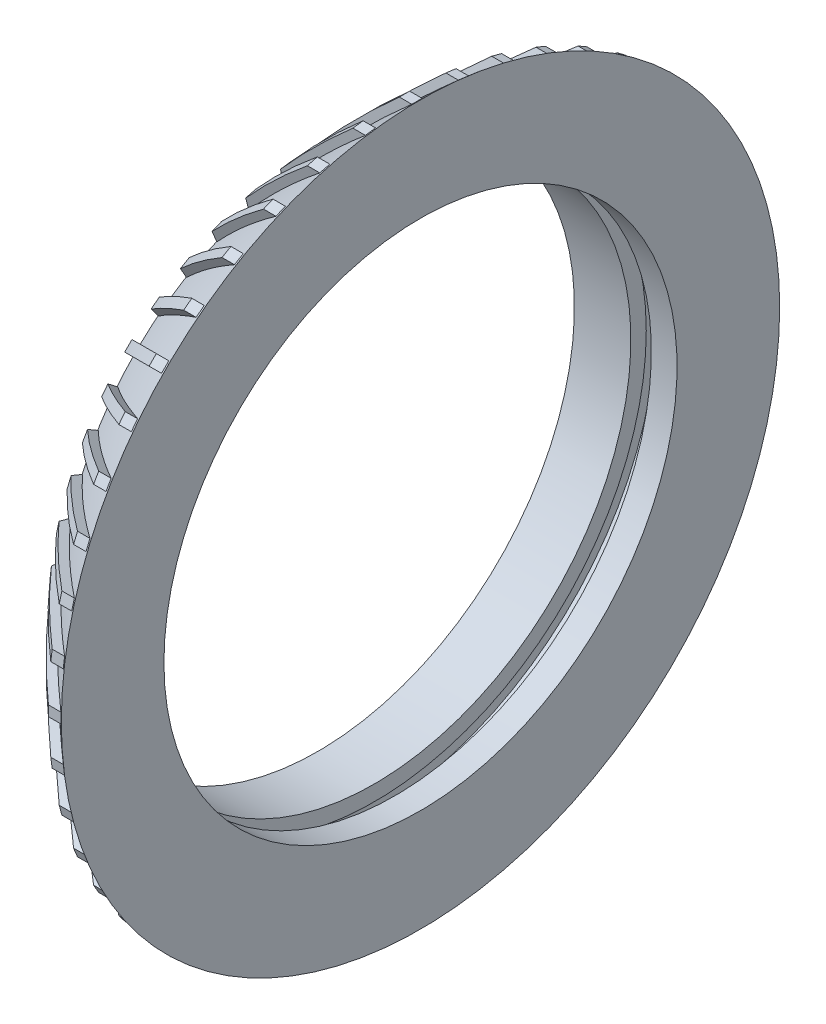
from build123d import *

# Parameters (mm, degrees)
BOSS_EXTRUDE1_DEPTH = 0.5
CIRPATTERN1_COUNT   = 48


with BuildPart() as part:
    # Sketch1 → Revolve1 (revolve)
    with BuildSketch(Plane(origin=(0, 0, 0), x_dir=(1, 0, 0), z_dir=(0, 1, 0)), mode=Mode.PRIVATE) as revolve1_sk:
        with BuildLine():
            Line((-10, 25), (-4.5, 25))
            Line((-4.5, 25), (-4.5, 26.5))
            Line((-4.5, 26.5), (-5, 26.5))
            Line((-5, 26.5), (-5, 28))
            Line((-5, 28), (-2, 28))
            Line((-2, 28), (-2, 26.5))
            Line((-2, 26.5), (-2.5, 26.5))
            Line((-2.5, 26.5), (-2.5, 25))
            Line((-2.5, 25), (0, 25))
            Line((0, 25), (0, 35))
            ThreePointArc((0, 35), (-5.17699822, 30.17699822), (-10, 25))
        make_face()
    revolve(revolve1_sk.sketch.rotate(Axis((-32.808988764, 0, 0), (1, 0, 0)), 180), axis=Axis((-32.808988764, 0, 0), (1, 0, 0)))

    # Sketch2 → Boss-Extrude1 (add, symmetric)
    with BuildSketch(Plane(origin=(0, 0, 0), x_dir=(1, 0, 0), z_dir=(0, 1, 0))):
        with BuildLine():
            Line((-9.670261687, 25.198786884), (-9.670261687, 26.585670293))
            ThreePointArc((-9.670261687, 26.585670293), (-5.729910505, 30.755454497), (-1.558714428, 34.694311059))
            Line((-1.558714428, 34.694311059), (-0.046724008, 34.694311059))
            ThreePointArc((-0.046724008, 34.694311059), (-5.019467946, 30.109694249), (-9.670261687, 25.198786884))
        make_face()
    boss_extrude1 = extrude(amount=BOSS_EXTRUDE1_DEPTH, both=True)

    # CirPattern1: Boss-Extrude1 ×48 about axis
    cirpattern1_axis = Axis((0, 0, 0), (1, 0, 0))
    for i in range(1, CIRPATTERN1_COUNT):
        add(boss_extrude1.rotate(cirpattern1_axis, i * 360 / CIRPATTERN1_COUNT))


solid = part.part
